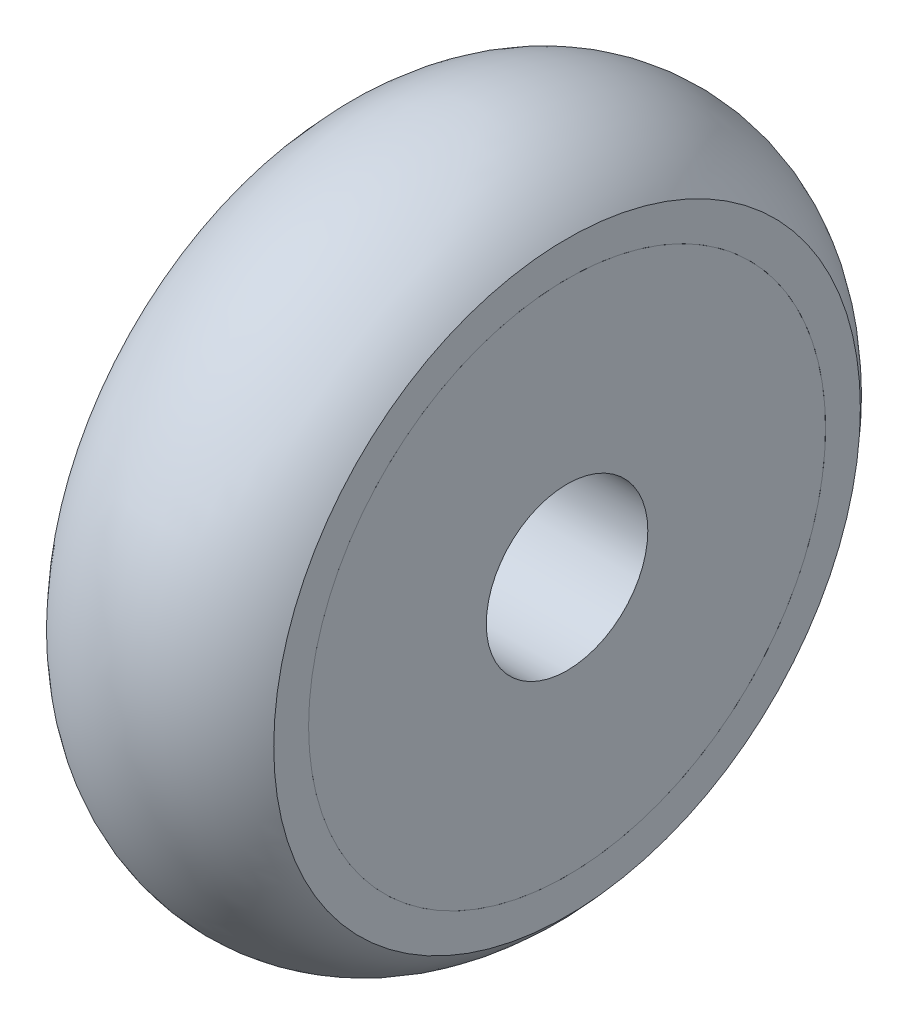
from build123d import *

# Parameters (mm, degrees)
EXTRUDE_START   = 3.5
SKETCH_3_R      = 8
SKETCH_3_R_2    = 2.5
EXTRUDE_1_DEPTH = 7


with BuildPart() as part:
    # Эскиз2 → Повернуть1 (revolve)
    with BuildSketch(Plane.XY, mode=Mode.PRIVATE) as revolve_1_sk:
        with BuildLine():
            Line((3.5, 8), (-3.5, 8))
            Line((-3.5, 8), (-3.5, 9.078427125))
            ThreePointArc((-3.5, 9.078427125), (0, 10.75), (3.5, 9.078427125))
            Line((3.5, 9.078427125), (3.5, 8))
        make_face()
    revolve(revolve_1_sk.sketch.rotate(Axis((-4.9172806, 0, 0), (1, 0, 0)), 90), axis=Axis((-4.9172806, 0, 0), (1, 0, 0)))


with BuildPart() as body_2:
    # Эскиз3 → Бобышка-Вытянуть1 (new body)
    with BuildSketch(Plane(origin=(0, 0, 0), x_dir=(0, 0, -1), z_dir=(1, 0, 0)).offset(EXTRUDE_START)):
        Circle(SKETCH_3_R)
        Circle(SKETCH_3_R_2, mode=Mode.SUBTRACT)
    extrude(amount=-EXTRUDE_1_DEPTH)


solid = Compound([part.part, body_2.part])
